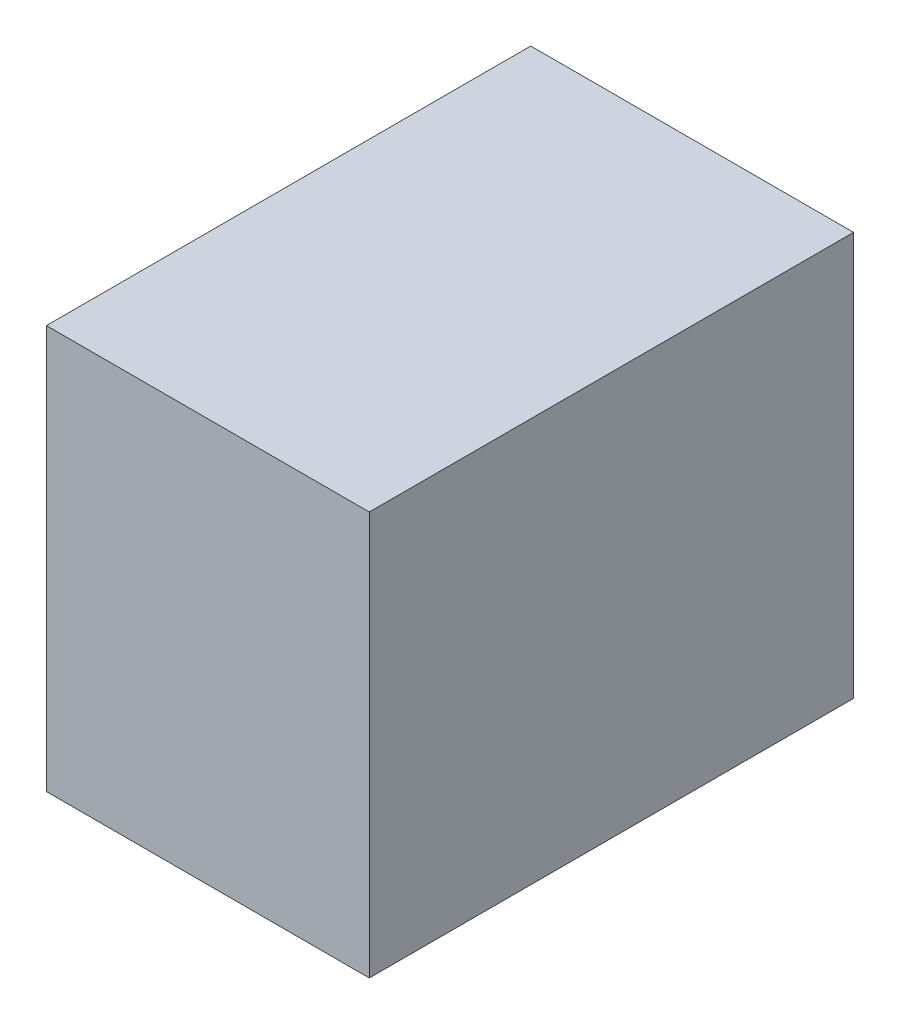
from build123d import *

# Parameters (mm, degrees)
SKETCH1_W           = 203.2
SKETCH1_H           = 254
BOSS_EXTRUDE1_DEPTH = 304.8


with BuildPart() as part:
    # Sketch1 → Boss-Extrude1 (new body)
    with BuildSketch(Plane.XY):
        Rectangle(SKETCH1_W, SKETCH1_H)
    extrude(amount=BOSS_EXTRUDE1_DEPTH)


solid = part.part
